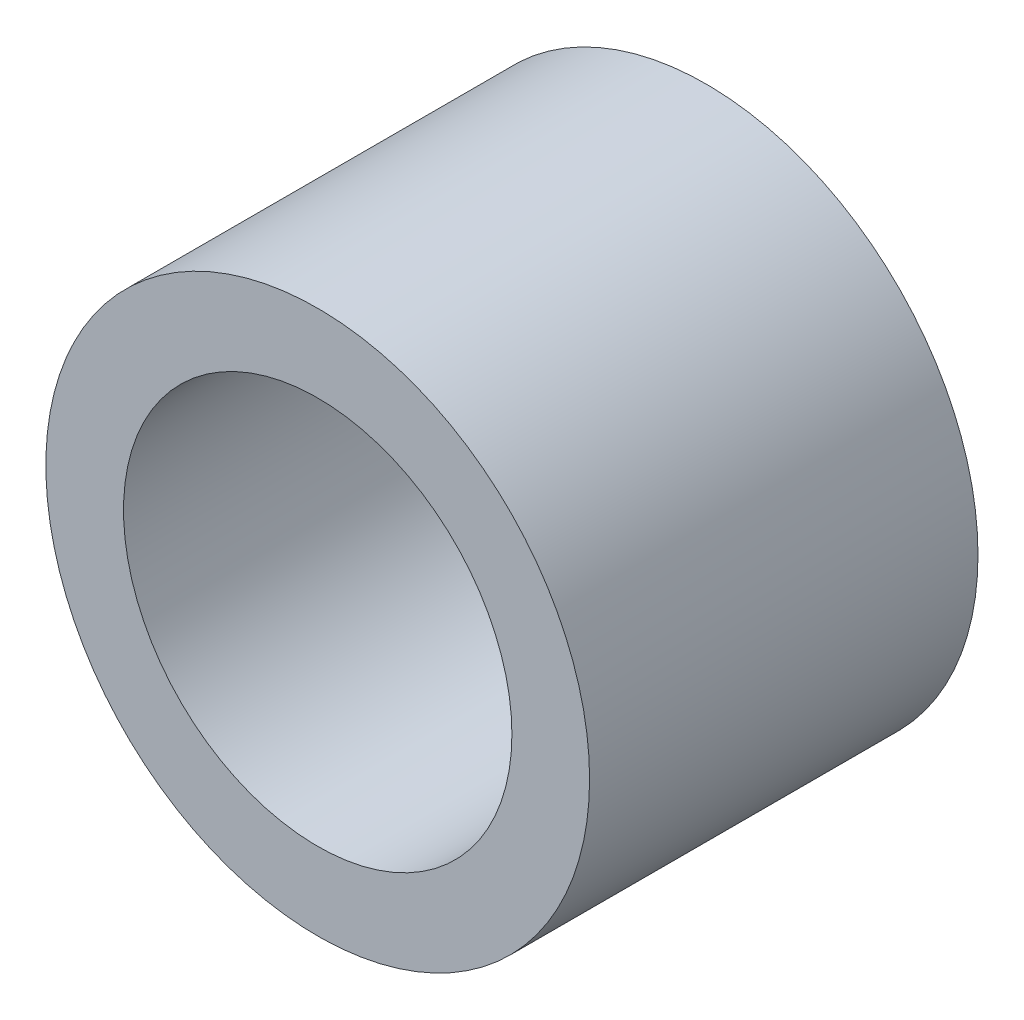
from build123d import *

# Parameters (mm, degrees)
SKETCH1_R           = 3.5
SKETCH1_R_2         = 2.5
BOSS_EXTRUDE1_DEPTH = 5


with BuildPart() as part:
    # Sketch1 → Boss-Extrude1 (new body)
    with BuildSketch(Plane.XY):
        Circle(SKETCH1_R)
        Circle(SKETCH1_R_2, mode=Mode.SUBTRACT)
    extrude(amount=BOSS_EXTRUDE1_DEPTH)


solid = part.part
